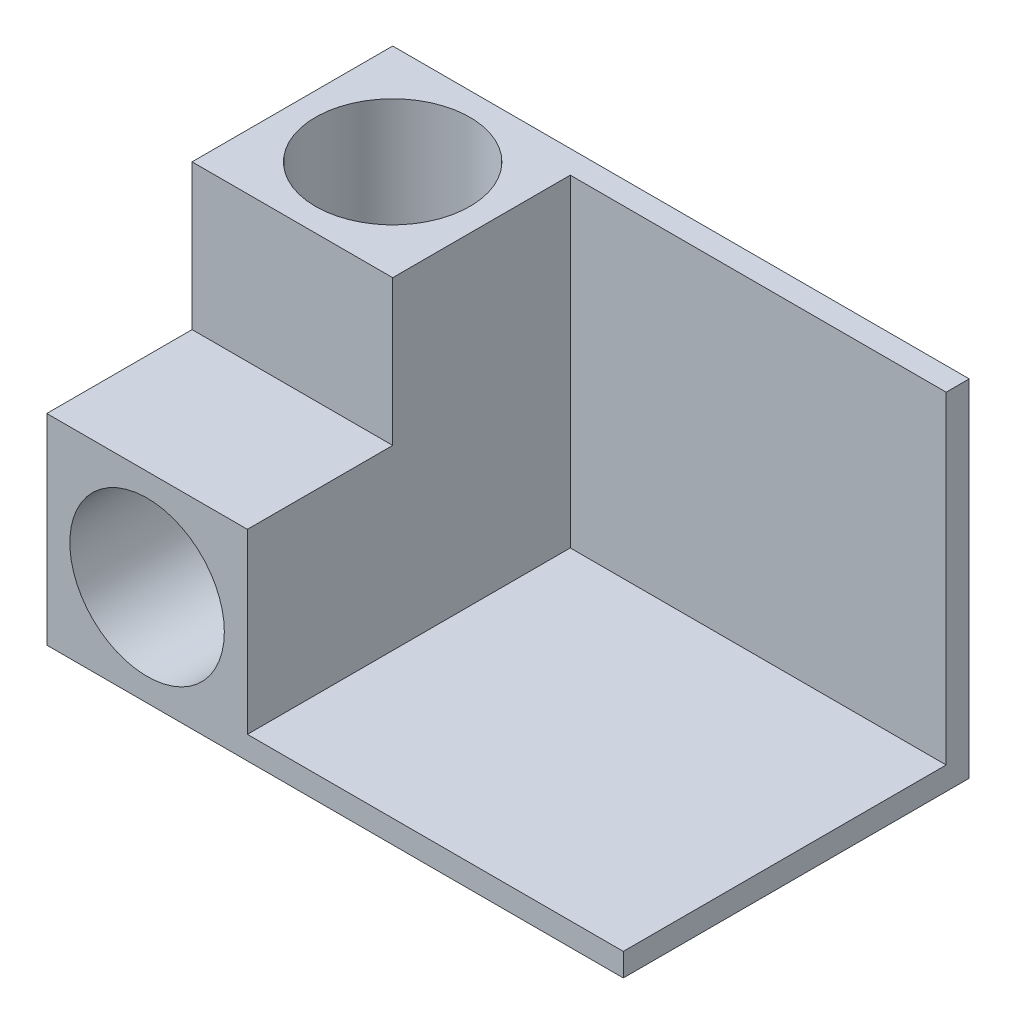
from build123d import *

# Parameters (mm, degrees)
SKETCH1_R           = 13.4
BOSS_EXTRUDE1_DEPTH = 56
SKETCH2_W           = 100
SKETCH2_H           = 60
BOSS_EXTRUDE2_DEPTH = 4
SKETCH3_R           = 13.4
CUT_EXTRUDE1_DEPTH  = 25.2
SKETCH4_W           = 25.2
SKETCH4_H           = 25.2
CUT_EXTRUDE2_DEPTH  = 51.2


with BuildPart() as part:
    # Sketch1 → Boss-Extrude1 (new body)
    with BuildSketch(Plane(origin=(0, 0, 0), x_dir=(1, 0, 0), z_dir=(0, 1, 0))):
        Polygon((-65.2, -11.320132013), (-65.2, 44.679867987), (0, 44.679867987), (0, 48.679867987), (-100, 48.679867987), (-100, -11.320132013), align=None)
        with Locations(Location((-82.6, 31.279867987, 0), (0, 0, 270))):
            Circle(SKETCH1_R, mode=Mode.SUBTRACT)
    extrude(amount=BOSS_EXTRUDE1_DEPTH)

    # Sketch2 → Boss-Extrude2 (add)
    with BuildSketch(Plane(origin=(0, 0, 0), x_dir=(1, 0, 0), z_dir=(0, 1, 0))):
        with Locations((-50, 18.679867987)):
            Rectangle(SKETCH2_W, SKETCH2_H)
    extrude(amount=-BOSS_EXTRUDE2_DEPTH)

    # Sketch3 → Cut-Extrude1 (cut)
    with BuildSketch(Plane.XY.offset(11.320132013)):
        with Locations((-82.6, 13.4)):
            Circle(SKETCH3_R)
    extrude(amount=-CUT_EXTRUDE1_DEPTH, mode=Mode.SUBTRACT)

    # Sketch4 → Cut-Extrude2 (cut)
    with BuildSketch(Plane.ZY.offset(100)):
        with Locations((-1.279867987, 43.4)):
            Rectangle(SKETCH4_W, SKETCH4_H)
    extrude(amount=-CUT_EXTRUDE2_DEPTH, mode=Mode.SUBTRACT)


solid = part.part
